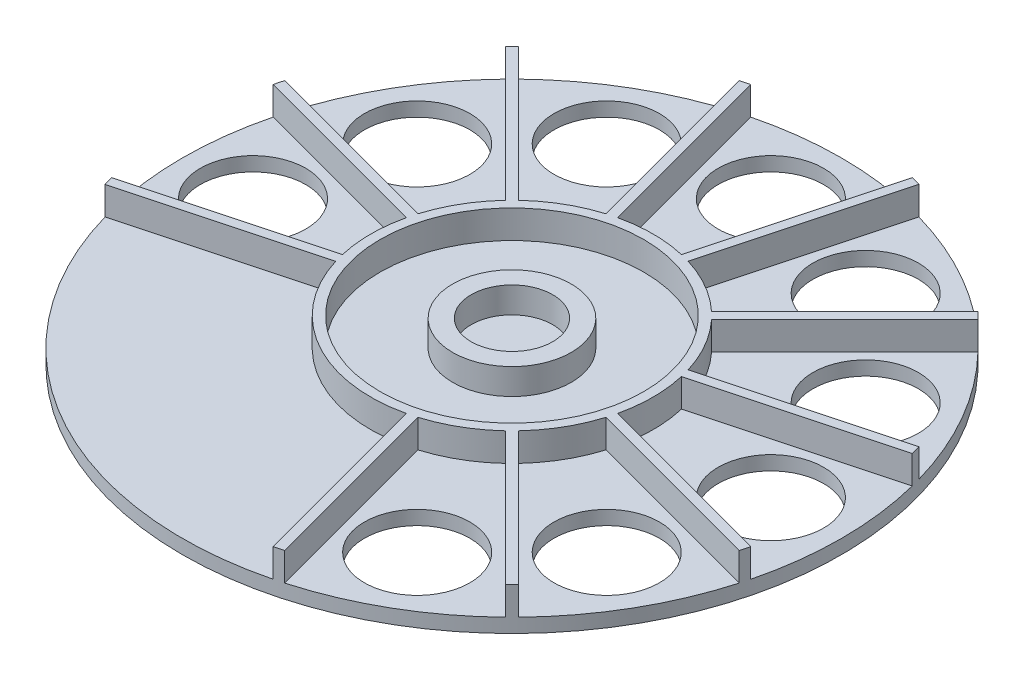
from build123d import *
from build123d.topology import SkipClean

# Parameters (mm, degrees)
SKETCH1_R           = 88.9
SKETCH1_R_2         = 14.224
BOSS_EXTRUDE1_DEPTH = 3.81
SKETCH3_R           = 38.1
SKETCH3_R_2         = 35.56
BOSS_EXTRUDE3_DEPTH = 7.62
BOSS_EXTRUDE4_DEPTH = 7.62
SKETCH4_R           = 16
SKETCH4_R_2         = 11
BOSS_EXTRUDE5_DEPTH = 7


with BuildPart() as part:
    # Sketch1 → Boss-Extrude1 (new body)
    with BuildSketch(Plane(origin=(0, 0, 0), x_dir=(1, 0, 0), z_dir=(0, 1, 0))):
        with Locations(Location((0, 0, 0), (0, 0, 90))):
            Circle(SKETCH1_R)
        with Locations(Location((-69.85, 0, 0), (0, 0, 90))):
            Circle(SKETCH1_R_2, mode=Mode.SUBTRACT)
        with Locations(Location((-60.491874454, 34.925, 0), (0, 0, 90))):
            Circle(SKETCH1_R_2, mode=Mode.SUBTRACT)
        with Locations(Location((-34.925, 60.491874454, 0), (0, 0, 90))):
            Circle(SKETCH1_R_2, mode=Mode.SUBTRACT)
        with Locations(Location((0, 69.85, 0), (0, 0, 90))):
            Circle(SKETCH1_R_2, mode=Mode.SUBTRACT)
        with Locations(Location((34.925, 60.491874454, 0), (0, 0, 90))):
            Circle(SKETCH1_R_2, mode=Mode.SUBTRACT)
        with Locations(Location((60.491874454, 34.925, 0), (0, 0, 90))):
            Circle(SKETCH1_R_2, mode=Mode.SUBTRACT)
        with Locations(Location((69.85, 0, 0), (0, 0, 90))):
            Circle(SKETCH1_R_2, mode=Mode.SUBTRACT)
        with Locations(Location((60.491874454, -34.925, 0), (0, 0, 90))):
            Circle(SKETCH1_R_2, mode=Mode.SUBTRACT)
        with Locations(Location((34.925, -60.491874454, 0), (0, 0, 90))):
            Circle(SKETCH1_R_2, mode=Mode.SUBTRACT)
    extrude(amount=BOSS_EXTRUDE1_DEPTH)

    # Sketch3 → Boss-Extrude3 (add)
    with BuildSketch(Plane(origin=(0, 3.81, 0), x_dir=(1, 0, 0), z_dir=(0, 1, 0))):
        with Locations(Location((0, 0, 0), (0, 0, 90))):
            Circle(SKETCH3_R)
        with Locations(Location((0, 0, 0), (0, 0, 90))):
            Circle(SKETCH3_R_2, mode=Mode.SUBTRACT)
    extrude(amount=BOSS_EXTRUDE3_DEPTH)

    # Sketch2 → Boss-Extrude4 (add)
    with SkipClean():  # the faces are left unmerged after this step: merging them gives an invalid solid
        with BuildSketch(Plane(origin=(0, 3.81, 0), x_dir=(1, 0, 0), z_dir=(0, 1, 0))):
            with BuildLine():
                Line((-86.19074337, -21.779939332), (-37.110023056, -8.62879996))
                ThreePointArc((-37.110023056, -8.62879996), (-36.801773982, -9.861005618), (-36.452622682, -11.082251559))
                Line((-36.452622682, -11.082251559), (-85.533342996, -24.233390931))
                ThreePointArc((-85.533342996, -24.233390931), (-85.870805957, -23.00901311), (-86.19074337, -21.779939332))
            make_face()
            with BuildLine():
                Line((-85.533342996, 24.233390931), (-36.452622682, 11.082251559))
                ThreePointArc((-36.452622682, 11.082251559), (-36.801773982, 9.861005618), (-37.110023056, 8.62879996))
                Line((-37.110023056, 8.62879996), (-86.19074337, 21.779939332))
                ThreePointArc((-86.19074337, 21.779939332), (-85.870805957, 23.00901311), (-85.533342996, 24.233390931))
            make_face()
            with BuildLine():
                Line((-61.957352439, 63.753403664), (-26.027771498, 27.823822722))
                ThreePointArc((-26.027771498, 27.823822722), (-26.940768363, 26.940768363), (-27.823822722, 26.027771498))
                Line((-27.823822722, 26.027771498), (-63.753403664, 61.957352439))
                ThreePointArc((-63.753403664, 61.957352439), (-62.861792847, 62.861792847), (-61.957352439, 63.753403664))
            make_face()
            with BuildLine():
                Line((-21.779939332, 86.19074337), (-8.62879996, 37.110023056))
                ThreePointArc((-8.62879996, 37.110023056), (-9.861005618, 36.801773982), (-11.082251559, 36.452622682))
                Line((-11.082251559, 36.452622682), (-24.233390931, 85.533342996))
                ThreePointArc((-24.233390931, 85.533342996), (-23.00901311, 85.870805957), (-21.779939332, 86.19074337))
            make_face()
            with BuildLine():
                Line((24.233390931, 85.533342996), (11.082251559, 36.452622682))
                ThreePointArc((11.082251559, 36.452622682), (9.861005618, 36.801773982), (8.62879996, 37.110023056))
                Line((8.62879996, 37.110023056), (21.779939332, 86.19074337))
                ThreePointArc((21.779939332, 86.19074337), (23.00901311, 85.870805957), (24.233390931, 85.533342996))
            make_face()
            with BuildLine():
                Line((63.753403664, 61.957352439), (27.823822722, 26.027771498))
                ThreePointArc((27.823822722, 26.027771498), (26.940768363, 26.940768363), (26.027771498, 27.823822722))
                Line((26.027771498, 27.823822722), (61.957352439, 63.753403664))
                ThreePointArc((61.957352439, 63.753403664), (62.861792847, 62.861792847), (63.753403664, 61.957352439))
            make_face()
            with BuildLine():
                Line((86.19074337, 21.779939332), (37.110023056, 8.62879996))
                ThreePointArc((37.110023056, 8.62879996), (36.801773982, 9.861005618), (36.452622682, 11.082251559))
                Line((36.452622682, 11.082251559), (85.533342996, 24.233390931))
                ThreePointArc((85.533342996, 24.233390931), (85.870805957, 23.00901311), (86.19074337, 21.779939332))
            make_face()
            with BuildLine():
                Line((85.533342996, -24.233390931), (36.452622682, -11.082251559))
                ThreePointArc((36.452622682, -11.082251559), (36.801773982, -9.861005618), (37.110023056, -8.62879996))
                Line((37.110023056, -8.62879996), (86.19074337, -21.779939332))
                ThreePointArc((86.19074337, -21.779939332), (85.870805957, -23.00901311), (85.533342996, -24.233390931))
            make_face()
            with BuildLine():
                Line((61.957352439, -63.753403664), (26.027771498, -27.823822722))
                ThreePointArc((26.027771498, -27.823822722), (26.940768363, -26.940768363), (27.823822722, -26.027771498))
                Line((27.823822722, -26.027771498), (63.753403664, -61.957352439))
                ThreePointArc((63.753403664, -61.957352439), (62.861792847, -62.861792847), (61.957352439, -63.753403664))
            make_face()
            with BuildLine():
                Line((21.779939332, -86.19074337), (8.62879996, -37.110023056))
                ThreePointArc((8.62879996, -37.110023056), (9.861005618, -36.801773982), (11.082251559, -36.452622682))
                Line((11.082251559, -36.452622682), (24.233390931, -85.533342996))
                ThreePointArc((24.233390931, -85.533342996), (23.00901311, -85.870805957), (21.779939332, -86.19074337))
            make_face()
        extrude(amount=BOSS_EXTRUDE4_DEPTH)

    # Sketch4 → Boss-Extrude5 (add)
    with SkipClean():  # the faces are left unmerged after this step: merging them gives an invalid solid
        with BuildSketch(Plane(origin=(0, 3.81, 0), x_dir=(1, 0, 0), z_dir=(0, 1, 0))):
            with Locations(Location((0, 0, 0), (0, 0, 270))):
                Circle(SKETCH4_R)
            with Locations(Location((0, 0, 0), (0, 0, 270))):
                Circle(SKETCH4_R_2, mode=Mode.SUBTRACT)
        extrude(amount=BOSS_EXTRUDE5_DEPTH)


solid = part.part
